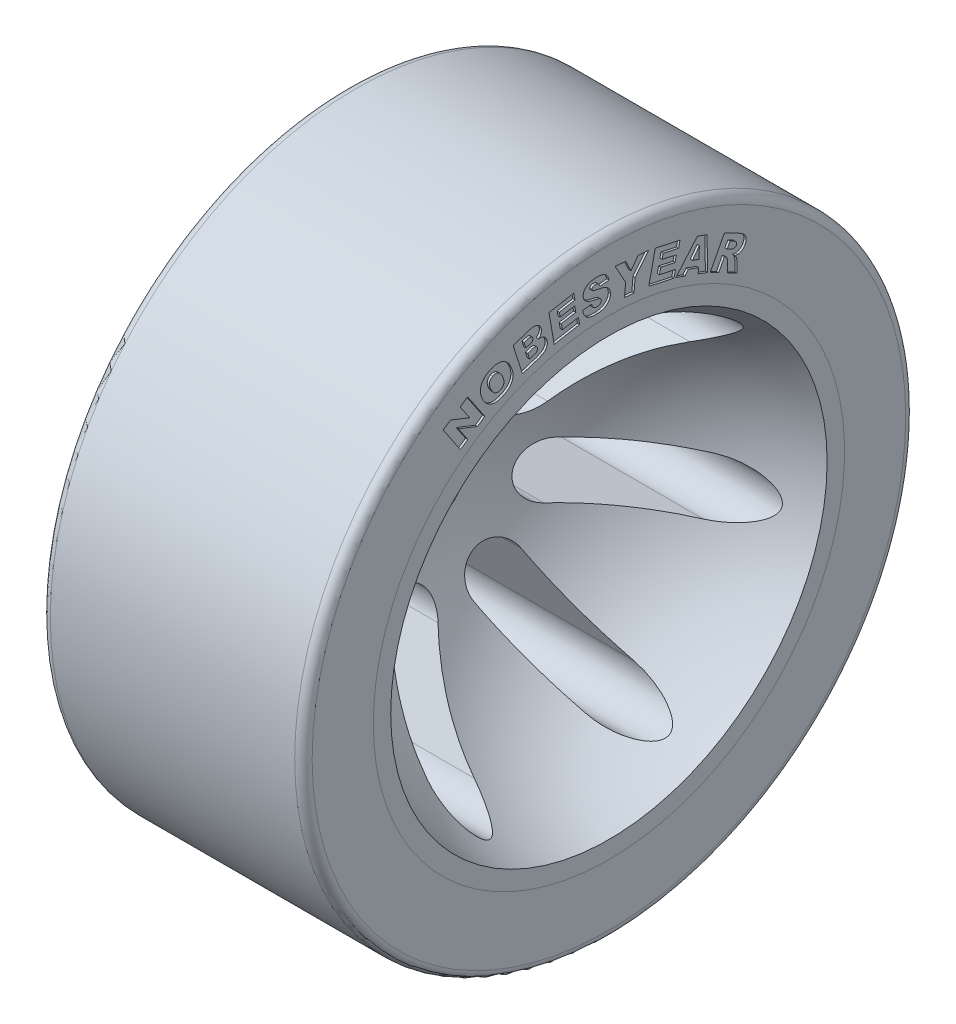
from build123d import *

# Parameters (mm, degrees)
SKETCH2_W           = 30
SKETCH2_H           = 8
FILLET1_R           = 1
SKETCH3_R           = 7.5
BOSS_EXTRUDE1_DEPTH = 10
SKETCH4_R           = 3.175
CUT_EXTRUDE1_DEPTH  = 64.63961048
CUT_EXTRUDE2_DEPTH  = 58.879184687
CIRPATTERN1_COUNT   = 7
CUT_EXTRUDE3_DEPTH  = 0.25


with BuildPart() as part:
    # Sketch1 → Hub (revolve)
    with BuildSketch(Plane.XY, mode=Mode.PRIVATE) as hub_sk:
        with BuildLine():
            Line((0, 0), (10, 0))
            ThreePointArc((10, 0), (15.47437581, 16.120499352), (30, 25))
            Line((30, 25), (30, 27))
            Line((30, 27), (0, 27))
            Line((0, 27), (0, 0))
        make_face()
    revolve(hub_sk.sketch.rotate(Axis((0, 0, 0), (1, 0, 0)), 90), axis=Axis((0, 0, 0), (1, 0, 0)))


with BuildPart() as body_2:
    # Sketch2 → Tire (revolve)
    with BuildSketch(Plane.XY, mode=Mode.PRIVATE) as tire_sk:
        with Locations((15, 31)):
            Rectangle(SKETCH2_W, SKETCH2_H)
    revolve(tire_sk.sketch.rotate(Axis((-1.5, 0, 0), (1, 0, 0)), 90), axis=Axis((-1.5, 0, 0), (1, 0, 0)))

    # Fillet1
    fillet1_edges = [body_2.edges().sort_by_distance(p)[0] for p in [
        (0, 0, -35),
        (30, 0, -35),
    ]]
    fillet(fillet1_edges, radius=FILLET1_R)

    # Sketch6 → Cut-Extrude3 (cut)
    # profile 1 of 9: a face of its own
    with BuildSketch(Plane(origin=(30, 0, 0), x_dir=(0, 0, -1), z_dir=(1, 0, 0))):
        Polygon((-18.993375251, 25.131214643), (-18.148204796, 25.700816915), (-15.952892296, 24.825106688), (-17.045221842, 26.445135097), (-16.192949114, 27.019708961), (-14.218517296, 24.091441915), (-15.070790023, 23.516868052), (-17.252608205, 24.384765779), (-16.16809116, 22.776811233), (-17.018943432, 22.202947597), align=None)
    # profile 2 of 9: a face of its own
    with BuildSketch(Plane(origin=(30, 0, 0), x_dir=(0, 0, -1), z_dir=(1, 0, 0))):
        with BuildLine():
            add(Edge.make_bspline(
                [(-14.495635258, 25.957333021), (-14.524596303, 26.020589457), (-14.581028049, 26.143847135), (-14.646506245, 26.331312387), (-14.693395657, 26.51475838), (-14.721109606, 26.694119267), (-14.731891855, 26.869219222), (-14.722710466, 27.040354689), (-14.693900257, 27.206982002), (-14.647855675, 27.369175888), (-14.583050319, 27.524329118), (-14.501536683, 27.672316029), (-14.401762005, 27.810938369), (-14.286497521, 27.942670247), (-14.152224142, 28.064159328), (-14.001879046, 28.177684617), (-13.834955016, 28.283854344), (-13.714486379, 28.344500075), (-13.652595485, 28.375656885)],
                knots=[0, 0, 0, 0, 1.147556844, 2.236060119, 3.271688379, 4.267888835, 5.226584, 6.161657968, 7.089078349, 8.011532036, 8.938013924, 9.857799998, 10.793330865, 11.751062409, 12.741000169, 13.775500434, 14.857160916, 16, 16, 16, 16], degree=3))
            add(Edge.make_bspline(
                [(-13.652595485, 28.375656885), (-13.588153108, 28.405088211), (-13.462728641, 28.462370524), (-13.272346669, 28.52911549), (-13.087164353, 28.578079959), (-12.906739334, 28.608648541), (-12.731031041, 28.619467165), (-12.560273136, 28.611830028), (-12.394282375, 28.585714388), (-12.234008297, 28.539850106), (-12.080483536, 28.476470656), (-11.934075203, 28.396493705), (-11.796874794, 28.298122661), (-11.666519863, 28.184297125), (-11.546714091, 28.051469993), (-11.433955718, 27.902856338), (-11.329308463, 27.737239922), (-11.268814833, 27.617903324), (-11.237822758, 27.556764839)],
                knots=[0, 0, 0, 0, 1.171891098, 2.280856497, 3.333726478, 4.338475981, 5.304026371, 6.241353904, 7.161752559, 8.078207226, 8.993455259, 9.905200075, 10.832452066, 11.781835806, 12.763505498, 13.786834529, 14.866151835, 16, 16, 16, 16], degree=3))
            add(Edge.make_bspline(
                [(-11.237822758, 27.556764839), (-11.216776094, 27.511506839), (-11.175519812, 27.42279079), (-11.122557619, 27.289193645), (-11.077445765, 27.1594792), (-11.041636142, 27.03284113), (-11.014466268, 26.909801214), (-10.996624844, 26.789937684), (-10.987198814, 26.673669281), (-10.986240898, 26.560640539), (-10.994493385, 26.450568799), (-11.009144918, 26.342997438), (-11.031812155, 26.237765575), (-11.062771529, 26.135161842), (-11.100158883, 26.034768394), (-11.145984884, 25.937045079), (-11.199525925, 25.841869025), (-11.259887269, 25.748619972), (-11.327869571, 25.658113998), (-11.405463414, 25.57206071), (-11.490397415, 25.488695034), (-11.584949601, 25.410205663), (-11.686619175, 25.333597175), (-11.797397772, 25.26162547), (-11.916561746, 25.193124035), (-11.999918502, 25.151292423), (-12.042510258, 25.129918249)],
                knots=[0, 0, 0, 0, 1.233425831, 2.417797208, 3.550282353, 4.626511627, 5.668653415, 6.66251431, 7.619322052, 8.549713982, 9.453126324, 10.345192288, 11.231211845, 12.110579057, 12.991988033, 13.87678948, 14.77533758, 15.689094136, 16.620644563, 17.569673324, 18.550355677, 19.55953236, 20.6045941, 21.695218295, 22.822354601, 24, 24, 24, 24], degree=3))
            add(Edge.make_bspline(
                [(-12.042510258, 25.129918249), (-12.086354926, 25.109367108), (-12.172042812, 25.069202959), (-12.301128787, 25.017397873), (-12.4267267, 24.973324492), (-12.549097186, 24.936558274), (-12.668492046, 24.908998922), (-12.784658408, 24.888844936), (-12.897563495, 24.876495568), (-13.007740178, 24.872749446), (-13.115753601, 24.8779365), (-13.222332822, 24.890700222), (-13.327846714, 24.911183315), (-13.432055276, 24.94058221), (-13.53497105, 24.978373512), (-13.636760317, 25.023969669), (-13.73737554, 25.077581326), (-13.836568168, 25.139133283), (-13.93343685, 25.209291557), (-14.025935439, 25.289495668), (-14.114897383, 25.378331476), (-14.199280297, 25.476653015), (-14.279753146, 25.583761706), (-14.356498603, 25.699642031), (-14.428917054, 25.824838306), (-14.473107328, 25.912595131), (-14.495635258, 25.957333021)],
                knots=[0, 0, 0, 0, 1.180994642, 2.308078441, 3.391145699, 4.427187976, 5.423184236, 6.378293821, 7.30174956, 8.191565589, 9.064524542, 9.936986702, 10.80793764, 11.683700077, 12.575257229, 13.480014828, 14.402314169, 15.354205886, 16.325656927, 17.316600957, 18.337483392, 19.389814632, 20.474358926, 21.60355643, 22.77830781, 24, 24, 24, 24], degree=3))
        make_face()
        with BuildLine():
            add(Edge.make_bspline(
                [(-13.518362531, 26.422531885), (-13.499368051, 26.384429117), (-13.462669583, 26.310812293), (-13.402715461, 26.207795241), (-13.342434216, 26.114897637), (-13.278614782, 26.034613369), (-13.214834226, 25.963960621), (-13.148805142, 25.905059063), (-13.081684256, 25.856194906), (-13.011871168, 25.820065683), (-12.941599213, 25.792754907), (-12.870192167, 25.775077666), (-12.798075575, 25.764518833), (-12.724860101, 25.764416504), (-12.650778688, 25.771365384), (-12.576067899, 25.787326062), (-12.500295977, 25.811395635), (-12.4511576, 25.833708481), (-12.426032985, 25.845117112)],
                knots=[0, 0, 0, 0, 1.451753448, 2.804874346, 4.063503266, 5.224980128, 6.299380172, 7.305912841, 8.238015884, 9.122931422, 9.979200078, 10.803697263, 11.627046977, 12.458787784, 13.294399992, 14.160661689, 15.059540244, 16, 16, 16, 16], degree=3))
            add(Edge.make_bspline(
                [(-12.426032985, 25.845117112), (-12.400933697, 25.857938744), (-12.351907486, 25.882983119), (-12.284007342, 25.927063436), (-12.224297427, 25.976227262), (-12.171820897, 26.029213825), (-12.126631359, 26.086158142), (-12.089568526, 26.147904263), (-12.059436252, 26.213546744), (-12.037072522, 26.284284316), (-12.023204468, 26.361095947), (-12.021157297, 26.445169149), (-12.0286034, 26.536260885), (-12.046040844, 26.634889483), (-12.074215074, 26.740923145), (-12.11298955, 26.854331423), (-12.161466017, 26.975422575), (-12.199540919, 27.057415706), (-12.219356849, 27.100088703)],
                knots=[0, 0, 0, 0, 0.928673853, 1.813970169, 2.662310032, 3.47351134, 4.268177454, 5.052467934, 5.841712529, 6.643854069, 7.49194263, 8.405541969, 9.407495453, 10.500610212, 11.70257545, 13.020409, 14.449283786, 16, 16, 16, 16], degree=3))
            add(Edge.make_bspline(
                [(-12.219356849, 27.100088703), (-12.237111081, 27.13585639), (-12.271389087, 27.20491288), (-12.328754093, 27.300823053), (-12.38664695, 27.387616977), (-12.447651501, 27.46351576), (-12.510410215, 27.529575442), (-12.575019089, 27.585553654), (-12.642337829, 27.630767274), (-12.711622216, 27.665884314), (-12.782432534, 27.691170515), (-12.85366271, 27.709706561), (-12.926038024, 27.71772445), (-12.999159019, 27.718795239), (-13.073151912, 27.710475083), (-13.148313168, 27.695113727), (-13.223961634, 27.669667379), (-13.273506755, 27.647614189), (-13.298902303, 27.636310294)],
                knots=[0, 0, 0, 0, 1.397080101, 2.697335408, 3.90846876, 5.045935185, 6.100820458, 7.093921255, 8.03154869, 8.932010844, 9.804868264, 10.658960914, 11.501724501, 12.346928528, 13.213470536, 14.102383644, 15.027330889, 16, 16, 16, 16], degree=3))
            add(Edge.make_bspline(
                [(-13.298902303, 27.636310294), (-13.322603701, 27.624227659), (-13.369135279, 27.600506523), (-13.43319581, 27.557640624), (-13.490555379, 27.509970612), (-13.540400178, 27.4569165), (-13.58421278, 27.399719572), (-13.621423093, 27.337650763), (-13.651155434, 27.270554355), (-13.674204896, 27.198749537), (-13.689437902, 27.121597862), (-13.694048936, 27.03851107), (-13.688466454, 26.949788526), (-13.674172533, 26.855163046), (-13.649610207, 26.754752494), (-13.614959193, 26.648945164), (-13.571636416, 26.536886328), (-13.536577904, 26.461631884), (-13.518362531, 26.422531885)],
                knots=[0, 0, 0, 0, 0.910332452, 1.787202857, 2.633136858, 3.458903744, 4.274460508, 5.09611858, 5.930751315, 6.781913036, 7.673830934, 8.615915255, 9.622742753, 10.713052165, 11.888854681, 13.15787868, 14.523317198, 16, 16, 16, 16], degree=3))
        make_face(mode=Mode.SUBTRACT)
    # profile 3 of 9: a face of its own
    with BuildSketch(Plane(origin=(30, 0, 0), x_dir=(0, 0, -1), z_dir=(1, 0, 0))):
        with BuildLine():
            Line((-10.972093337, 29.516051209), (-9.033172883, 30.131818255))
            add(Edge.make_bspline(
                [(-9.033172883, 30.131818255), (-8.993777011, 30.143453979), (-8.917014662, 30.166126038), (-8.802688195, 30.190749367), (-8.692602855, 30.203770949), (-8.587377923, 30.209843413), (-8.486743225, 30.203739521), (-8.390727264, 30.189168033), (-8.29920465, 30.164169495), (-8.212880042, 30.129447201), (-8.132776766, 30.086388144), (-8.058344647, 30.038606835), (-7.991820964, 29.983074782), (-7.93175565, 29.921944297), (-7.879083333, 29.854108654), (-7.833490988, 29.780179792), (-7.793807083, 29.70080344), (-7.774484441, 29.64415019), (-7.764706974, 29.615483028)],
                knots=[0, 0, 0, 0, 1.279270881, 2.492642879, 3.636824276, 4.729372547, 5.770756104, 6.77091085, 7.749411328, 8.718867964, 9.662287293, 10.578544374, 11.468857279, 12.355314276, 13.243272782, 14.137455373, 15.05753212, 16, 16, 16, 16], degree=3))
            add(Edge.make_bspline(
                [(-7.764706974, 29.615483028), (-7.757353452, 29.59098234), (-7.742866387, 29.542713897), (-7.729818773, 29.469108451), (-7.722243821, 29.396446928), (-7.722466619, 29.324612817), (-7.728874146, 29.253543684), (-7.74171248, 29.183442271), (-7.760627604, 29.113785869), (-7.778906463, 29.069149765), (-7.788144474, 29.046590982)],
                knots=[0, 0, 0, 0, 1.053603469, 2.075688686, 3.075829499, 4.061439649, 5.031516672, 6.013448437, 6.996010376, 8, 8, 8, 8], degree=3))
            add(Edge.make_bspline(
                [(-7.788144474, 29.046590982), (-7.803064206, 29.016426018), (-7.833911088, 28.954059277), (-7.90075304, 28.868372959), (-7.982009048, 28.784482553), (-8.04553723, 28.73453776), (-8.078627428, 28.7085228)],
                knots=[0, 0, 0, 0, 0.894549398, 1.849500995, 2.879860327, 4, 4, 4, 4], degree=3))
            add(Edge.make_bspline(
                [(-8.078627428, 28.7085228), (-8.046914852, 28.710024375), (-7.985163504, 28.712948272), (-7.894732249, 28.711937213), (-7.809075222, 28.703920076), (-7.728244782, 28.690843134), (-7.652096636, 28.671226791), (-7.580337485, 28.647116739), (-7.513986946, 28.615089868), (-7.451666598, 28.578971054), (-7.39409235, 28.537037105), (-7.341286053, 28.489489689), (-7.29201646, 28.437922933), (-7.247784697, 28.380247902), (-7.207367606, 28.317813149), (-7.170991598, 28.250236574), (-7.139812495, 28.177285715), (-7.122343376, 28.126490157), (-7.113428565, 28.100568255)],
                knots=[0, 0, 0, 0, 1.22059454, 2.376765533, 3.473654745, 4.525662559, 5.521345012, 6.494342261, 7.430846902, 8.348809484, 9.260977018, 10.16355646, 11.077901442, 11.999197657, 12.953580485, 13.935056434, 14.946221559, 16, 16, 16, 16], degree=3))
            add(Edge.make_bspline(
                [(-7.113428565, 28.100568255), (-7.101375361, 28.057731257), (-7.077678836, 27.973513981), (-7.062571174, 27.844612762), (-7.063405047, 27.717496093), (-7.083054418, 27.593352818), (-7.117835612, 27.473817091), (-7.16726452, 27.36059997), (-7.231072845, 27.254113016), (-7.285059127, 27.191235383), (-7.312292201, 27.159517118)],
                knots=[0, 0, 0, 0, 1.057525373, 2.079088399, 3.076269033, 4.073783777, 5.0596339, 6.030890041, 7.00669366, 8, 8, 8, 8], degree=3))
            add(Edge.make_bspline(
                [(-7.312292201, 27.159517118), (-7.332648904, 27.139543141), (-7.376634455, 27.096384563), (-7.458853482, 27.039096396), (-7.557485472, 26.980069376), (-7.63110424, 26.944208864), (-7.670246746, 26.925142118)],
                knots=[0, 0, 0, 0, 0.794468545, 1.716640263, 2.785956023, 4, 4, 4, 4], degree=3))
            add(Edge.make_bspline(
                [(-7.670246746, 26.925142118), (-7.696949021, 26.912486591), (-7.748067676, 26.888258936), (-7.821993442, 26.855293725), (-7.888472572, 26.825051084), (-7.948548027, 26.799972619), (-8.000857307, 26.77655857), (-8.047068969, 26.758537239), (-8.085881805, 26.743134397), (-8.109840474, 26.735407876), (-8.120530837, 26.7319603)],
                knots=[0, 0, 0, 0, 1.446630275, 2.769419248, 3.962732965, 5.021979233, 5.956434204, 6.767851108, 7.450214908, 8, 8, 8, 8], degree=3))
            Line((-8.120530837, 26.7319603), (-9.908172883, 26.164488709))
            Line((-9.908172883, 26.164488709), (-10.972093337, 29.516051209))
        make_face()
        with BuildLine():
            Line((-9.509735383, 28.533096664), (-9.059451292, 28.675852346))
            add(Edge.make_bspline(
                [(-9.059451292, 28.675852346), (-9.040225884, 28.68233907), (-9.003171143, 28.694841479), (-8.950550547, 28.715145022), (-8.90334047, 28.737252621), (-8.861586812, 28.760549085), (-8.824912088, 28.784576596), (-8.793973451, 28.810144245), (-8.768995559, 28.837401853), (-8.742227268, 28.874228724), (-8.719429158, 28.925429091), (-8.707406831, 28.992306694), (-8.710480647, 29.064558069), (-8.723676894, 29.112362425), (-8.730616065, 29.137500073)],
                knots=[0, 0, 0, 0, 1.120953654, 2.160507993, 3.11423721, 3.99843588, 4.800136749, 5.533640066, 6.209358931, 6.83731205, 8.043184075, 9.266870723, 10.562799556, 12, 12, 12, 12], degree=3))
            add(Edge.make_bspline(
                [(-8.730616065, 29.137500073), (-8.738865225, 29.160461615), (-8.754689514, 29.204508531), (-8.793449264, 29.260933946), (-8.84084851, 29.306080706), (-8.888364866, 29.332753461), (-8.930671369, 29.348109176), (-8.966591748, 29.355035371), (-9.005909327, 29.357568744), (-9.048643903, 29.35666949), (-9.095284355, 29.352623504), (-9.145197265, 29.342853158), (-9.198770927, 29.330113862), (-9.235163773, 29.319266688), (-9.254053565, 29.313636437)],
                knots=[0, 0, 0, 0, 1.386527332, 2.659762711, 3.863298009, 5.090828397, 5.735661307, 6.424109439, 7.168657542, 7.978864769, 8.860198351, 9.834746752, 10.876120286, 12, 12, 12, 12], degree=3))
            Line((-9.254053565, 29.313636437), (-9.711439928, 29.168750073))
            Line((-9.711439928, 29.168750073), (-9.509735383, 28.533096664))
        make_face(mode=Mode.SUBTRACT)
        with BuildLine():
            Line((-9.092121746, 27.2163353), (-8.563712655, 27.383948937))
            add(Edge.make_bspline(
                [(-8.563712655, 27.383948937), (-8.542317621, 27.391046939), (-8.501055517, 27.404736027), (-8.443109487, 27.428298958), (-8.390528588, 27.452166404), (-8.344353054, 27.478564395), (-8.303566843, 27.506164352), (-8.268783067, 27.5351349), (-8.239420019, 27.565279417), (-8.209886249, 27.607588432), (-8.1822873, 27.663739409), (-8.167762136, 27.736394705), (-8.167948801, 27.812607248), (-8.181143595, 27.8623522), (-8.188002428, 27.8882103)],
                knots=[0, 0, 0, 0, 1.133131178, 2.185337813, 3.1439592, 4.034294013, 4.856444491, 5.616995985, 6.307426723, 6.964737626, 8.205324068, 9.421686987, 10.659757952, 12, 12, 12, 12], degree=3))
            add(Edge.make_bspline(
                [(-8.188002428, 27.8882103), (-8.196655563, 27.911692847), (-8.213380096, 27.95707925), (-8.255516282, 28.015530939), (-8.308547244, 28.062092904), (-8.361685263, 28.090244085), (-8.409766433, 28.105055754), (-8.450430228, 28.113055319), (-8.495534571, 28.115675412), (-8.544645838, 28.1128816), (-8.598137041, 28.107594814), (-8.655658263, 28.09636803), (-8.717545634, 28.08155263), (-8.759795305, 28.068828634), (-8.781752428, 28.062215982)],
                knots=[0, 0, 0, 0, 1.277628968, 2.469365164, 3.647187149, 4.868265973, 5.516742257, 6.221036158, 6.986902775, 7.824814305, 8.739889839, 9.739304934, 10.82511843, 12, 12, 12, 12], degree=3))
            Line((-8.781752428, 28.062215982), (-9.30732061, 27.895312573))
            Line((-9.30732061, 27.895312573), (-9.092121746, 27.2163353))
        make_face(mode=Mode.SUBTRACT)
    # profile 4 of 9: a face of its own
    with BuildSketch(Plane(origin=(30, 0, 0), x_dir=(0, 0, -1), z_dir=(1, 0, 0))):
        Polygon((-6.873120161, 30.717790475), (-4.017296297, 31.221341611), (-3.888034934, 30.484835929), (-5.676387206, 30.16949502), (-5.579796297, 29.621909793), (-3.920705388, 29.914523429), (-3.796415615, 29.210688202), (-5.455506524, 28.918074566), (-5.335478115, 28.238387066), (-3.495279252, 28.562960929), (-3.357495161, 27.781710929), (-6.265165615, 27.268926838), align=None)
    # profile 5 of 9: a face of its own
    with BuildSketch(Plane(origin=(30, 0, 0), x_dir=(0, 0, -1), z_dir=(1, 0, 0))):
        with BuildLine():
            Line((-3.011666543, 28.996198137), (-1.982547225, 29.111254955))
            add(Edge.make_bspline(
                [(-1.982547225, 29.111254955), (-1.974070123, 29.071992448), (-1.957987793, 28.997505603), (-1.923463422, 28.894507436), (-1.881029971, 28.806257579), (-1.843883831, 28.757301989), (-1.826297225, 28.734124274)],
                knots=[0, 0, 0, 0, 1.167882679, 2.215648025, 3.155209809, 4, 4, 4, 4], degree=3))
            add(Edge.make_bspline(
                [(-1.826297225, 28.734124274), (-1.81100651, 28.717920812), (-1.780810254, 28.685922056), (-1.729883926, 28.644113465), (-1.674251989, 28.610182679), (-1.614722888, 28.582731402), (-1.550886357, 28.563074755), (-1.483104552, 28.54943325), (-1.410930047, 28.543154069), (-1.361578982, 28.544039157), (-1.336240407, 28.544493592)],
                knots=[0, 0, 0, 0, 0.980712201, 1.936720183, 2.891760862, 3.843665298, 4.81658511, 5.82684459, 6.884225486, 8, 8, 8, 8], degree=3))
            add(Edge.make_bspline(
                [(-1.336240407, 28.544493592), (-1.299594653, 28.547315782), (-1.230131004, 28.552665369), (-1.13381727, 28.578814585), (-1.050472266, 28.615879717), (-0.983252938, 28.667798973), (-0.931551988, 28.727724882), (-0.893103036, 28.791203041), (-0.872058388, 28.859940291), (-0.870911142, 28.906576657), (-0.870331316, 28.930147001)],
                knots=[0, 0, 0, 0, 1.306717763, 2.4769414, 3.537240005, 4.535870782, 5.474467313, 6.343818816, 7.162954521, 8, 8, 8, 8], degree=3))
            add(Edge.make_bspline(
                [(-0.870331316, 28.930147001), (-0.872832149, 28.952408123), (-0.877857096, 28.997137614), (-0.904889402, 29.060769645), (-0.946350397, 29.119587133), (-0.982769382, 29.152410779), (-1.001723362, 29.169493592)],
                knots=[0, 0, 0, 0, 0.951977257, 1.91281726, 2.913741864, 4, 4, 4, 4], degree=3))
            add(Edge.make_bspline(
                [(-1.001723362, 29.169493592), (-1.013608999, 29.17807731), (-1.039590169, 29.196840716), (-1.086348715, 29.220473928), (-1.142975022, 29.242710866), (-1.208703095, 29.265541518), (-1.284698656, 29.286612147), (-1.370280881, 29.306898903), (-1.465710846, 29.326877489), (-1.532700379, 29.338719522), (-1.567774498, 29.344919728)],
                knots=[0, 0, 0, 0, 0.588585232, 1.286606049, 2.097669232, 3.033543426, 4.081817059, 5.265813536, 6.568445323, 8, 8, 8, 8], degree=3))
            add(Edge.make_bspline(
                [(-1.567774498, 29.344919728), (-1.62587659, 29.355557019), (-1.73849675, 29.376175441), (-1.900219846, 29.414088246), (-2.049754766, 29.454732592), (-2.186249081, 29.500217609), (-2.31022189, 29.54891695), (-2.421615376, 29.601570891), (-2.521233216, 29.657504009), (-2.580006114, 29.701096222), (-2.608257452, 29.72205041)],
                knots=[0, 0, 0, 0, 1.269179615, 2.460069949, 3.568456884, 4.59810589, 5.550403483, 6.428828684, 7.244759161, 8, 8, 8, 8], degree=3))
            add(Edge.make_bspline(
                [(-2.608257452, 29.72205041), (-2.6338282, 29.743310645), (-2.684145145, 29.785145561), (-2.750370102, 29.855938187), (-2.807262081, 29.931834228), (-2.85382164, 30.013278928), (-2.892899683, 30.098810231), (-2.921365042, 30.189933042), (-2.93970972, 30.286038622), (-2.945040487, 30.351949821), (-2.947746089, 30.385402683)],
                knots=[0, 0, 0, 0, 1.035814183, 2.038227726, 3.01385107, 3.985979199, 4.957098373, 5.939730276, 6.95432157, 8, 8, 8, 8], degree=3))
            add(Edge.make_bspline(
                [(-2.947746089, 30.385402683), (-2.948290232, 30.430247989), (-2.949375287, 30.519672407), (-2.924266304, 30.652295819), (-2.881060875, 30.781751183), (-2.829627744, 30.885930541), (-2.77774403, 30.965706157), (-2.734035618, 31.024014552), (-2.684496956, 31.078757767), (-2.630646976, 31.131121669), (-2.570322527, 31.178785808), (-2.506632437, 31.225738116), (-2.436563297, 31.267839745), (-2.361758701, 31.308166272), (-2.280105801, 31.344462624), (-2.19141035, 31.377089141), (-2.094958016, 31.405181189), (-1.991518396, 31.43036964), (-1.880078805, 31.449444578), (-1.761758433, 31.466845244), (-1.635683758, 31.479607157), (-1.549095738, 31.484466213), (-1.504564271, 31.486965183)],
                knots=[0, 0, 0, 0, 1.316125397, 2.624438466, 3.945397879, 5.32158219, 6.026437792, 6.742143739, 7.461968988, 8.195633488, 8.948052299, 9.720967213, 10.520969045, 11.349455066, 12.21893339, 13.146248361, 14.126516352, 15.171777512, 16.275215779, 17.449826113, 18.688467715, 20, 20, 20, 20], degree=3))
            add(Edge.make_bspline(
                [(-1.504564271, 31.486965183), (-1.450122759, 31.488991157), (-1.34431471, 31.492928674), (-1.190131464, 31.488671896), (-1.045512235, 31.475793444), (-0.910186737, 31.456144838), (-0.785100699, 31.425696121), (-0.668818832, 31.389550875), (-0.562798897, 31.342855682), (-0.465072246, 31.289128831), (-0.37709259, 31.225169369), (-0.297369609, 31.152521925), (-0.227503649, 31.068923397), (-0.165352131, 30.976197979), (-0.112234162, 30.873351413), (-0.067457458, 30.76107151), (-0.031050173, 30.639352355), (-0.014485165, 30.554133358), (-0.005984725, 30.510402683)],
                knots=[0, 0, 0, 0, 1.304710694, 2.535728524, 3.691402443, 4.781318336, 5.807390719, 6.772214376, 7.694051888, 8.577521148, 9.438463607, 10.293314968, 11.154444162, 12.041491448, 12.962194541, 13.92150306, 14.933405936, 16, 16, 16, 16], degree=3))
            Line((-0.005984725, 30.510402683), (-1.026581316, 30.400317455))
            add(Edge.make_bspline(
                [(-1.026581316, 30.400317455), (-1.035848043, 30.43715853), (-1.053374741, 30.506838189), (-1.09601354, 30.600448923), (-1.147579649, 30.678936641), (-1.21290032, 30.739274514), (-1.288545123, 30.784574029), (-1.37607169, 30.813186727), (-1.474619828, 30.829102064), (-1.544039714, 30.827832114), (-1.580558589, 30.827164046)],
                knots=[0, 0, 0, 0, 1.170341321, 2.213534329, 3.160037379, 4.049298802, 4.934045414, 5.860679878, 6.874593898, 8, 8, 8, 8], degree=3))
            add(Edge.make_bspline(
                [(-1.580558589, 30.827164046), (-1.610270561, 30.824962671), (-1.66630179, 30.820811287), (-1.743818006, 30.801700764), (-1.809547874, 30.773284641), (-1.86271476, 30.735577133), (-1.903165799, 30.690832792), (-1.931832186, 30.6418481), (-1.94738337, 30.588286635), (-1.948095281, 30.551689617), (-1.948456316, 30.533129955)],
                knots=[0, 0, 0, 0, 1.353945565, 2.553288448, 3.614351042, 4.594972503, 5.495056103, 6.339588046, 7.157945502, 8, 8, 8, 8], degree=3))
            add(Edge.make_bspline(
                [(-1.948456316, 30.533129955), (-1.946716658, 30.519487201), (-1.943212584, 30.492007538), (-1.926063238, 30.452502766), (-1.898241703, 30.416568745), (-1.874309664, 30.396563037), (-1.861808589, 30.38611291)],
                knots=[0, 0, 0, 0, 0.933221435, 1.87972389, 2.892458343, 4, 4, 4, 4], degree=3))
            add(Edge.make_bspline(
                [(-1.861808589, 30.38611291), (-1.854130042, 30.380455169), (-1.837400676, 30.368128561), (-1.807034677, 30.35297863), (-1.770510575, 30.337969212), (-1.727199696, 30.324124214), (-1.677431257, 30.310634534), (-1.62115242, 30.298245606), (-1.55858267, 30.284926824), (-1.514313533, 30.278160105), (-1.491069952, 30.274607228)],
                knots=[0, 0, 0, 0, 0.585439607, 1.275506188, 2.078241647, 3.012558428, 4.068225543, 5.24748728, 6.554788863, 8, 8, 8, 8], degree=3))
            add(Edge.make_bspline(
                [(-1.491069952, 30.274607228), (-1.433253685, 30.264948101), (-1.321442286, 30.24626823), (-1.160585209, 30.214647189), (-1.012015362, 30.183698455), (-0.876130311, 30.152172526), (-0.753427561, 30.118442696), (-0.642686988, 30.085661917), (-0.545005525, 30.050749492), (-0.457946474, 30.015860906), (-0.38051275, 29.978162563), (-0.308649946, 29.939366177), (-0.243164825, 29.89631529), (-0.181167491, 29.852576715), (-0.125414228, 29.804956718), (-0.074491932, 29.754987098), (-0.028845514, 29.702279761), (0.024684115, 29.628848453), (0.080432865, 29.530869685), (0.131495642, 29.405717733), (0.164858531, 29.272169007), (0.172604779, 29.180092281), (0.176543684, 29.133272001)],
                knots=[0, 0, 0, 0, 1.586058795, 3.067293336, 4.435502218, 5.692554233, 6.840968207, 7.878547516, 8.816653854, 9.6469951, 10.414864224, 11.145966122, 11.854954902, 12.53411506, 13.197688365, 13.836398904, 14.4631432, 15.082013553, 16.292939842, 17.502747273, 18.730166912, 20, 20, 20, 20], degree=3))
            add(Edge.make_bspline(
                [(0.176543684, 29.133272001), (0.177484524, 29.105333439), (0.179351808, 29.049883841), (0.173901836, 28.967266082), (0.163213868, 28.885900221), (0.147260209, 28.805728078), (0.123950147, 28.727119258), (0.09582572, 28.649867081), (0.061363099, 28.57391147), (0.021044463, 28.499995485), (-0.024090224, 28.428273233), (-0.074713799, 28.360625242), (-0.130241989, 28.297189252), (-0.191018739, 28.238079849), (-0.256289184, 28.182819293), (-0.326231145, 28.1310748), (-0.401777666, 28.084757965), (-0.481554117, 28.040878441), (-0.566747977, 28.001900289), (-0.65782854, 27.967922402), (-0.753938028, 27.937286302), (-0.856243867, 27.911847276), (-0.964113449, 27.890653317), (-1.077650247, 27.873820291), (-1.196817089, 27.860797104), (-1.278210774, 27.855933742), (-1.31990518, 27.853442455)],
                knots=[0, 0, 0, 0, 0.907841004, 1.801789935, 2.686289387, 3.573360791, 4.454609566, 5.347763817, 6.242870393, 7.161918535, 8.08170682, 8.994034228, 9.904381242, 10.818263975, 11.746091092, 12.681540138, 13.64208207, 14.623135022, 15.638569274, 16.682961011, 17.780182393, 18.914527289, 20.106337836, 21.350901325, 22.642983246, 24, 24, 24, 24], degree=3))
            add(Edge.make_bspline(
                [(-1.31990518, 27.853442455), (-1.391868328, 27.850942767), (-1.530129981, 27.846140154), (-1.729604439, 27.852668179), (-1.912501901, 27.869440395), (-2.078804105, 27.899226358), (-2.228877604, 27.93952772), (-2.362116198, 27.993011553), (-2.479339236, 28.057211232), (-2.579325771, 28.134803733), (-2.665238435, 28.221271163), (-2.742537556, 28.313048219), (-2.810164818, 28.411743932), (-2.869224197, 28.516240688), (-2.919414431, 28.62715835), (-2.95952692, 28.744486893), (-2.991198528, 28.86800869), (-3.004765647, 28.952978408), (-3.011666543, 28.996198137)],
                knots=[0, 0, 0, 0, 1.500405067, 2.882704403, 4.156788487, 5.324994039, 6.399978045, 7.389547468, 8.310678103, 9.176211009, 10.017074736, 10.847214878, 11.673887025, 12.506852549, 13.346035243, 14.207394979, 15.088193946, 16, 16, 16, 16], degree=3))
        make_face()
    # profile 6 of 9: a face of its own
    with BuildSketch(Plane(origin=(30, 0, 0), x_dir=(0, 0, -1), z_dir=(1, 0, 0))):
        Polygon((0.71559655, 31.510405635), (1.920852232, 31.409553362), (2.530937459, 30.163104499), (3.339886323, 31.290235181), (4.538749959, 31.190093135), (3.001107914, 29.26182609), (2.877528369, 27.790235181), (1.789460187, 27.881854499), (1.913039732, 29.353445408), align=None)
    # profile 7 of 9: a face of its own
    with BuildSketch(Plane(origin=(30, 0, 0), x_dir=(0, 0, -1), z_dir=(1, 0, 0))):
        Polygon((5.310172541, 31.02069381), (8.139007768, 30.404216537), (7.979916859, 29.674813128), (6.209320268, 30.061176764), (6.090712314, 29.518563128), (7.733467996, 29.159898355), (7.581479359, 28.463165401), (5.938723678, 28.821830173), (5.791706632, 28.147824492), (7.614149814, 27.750097219), (7.44582595, 26.976659719), (4.565144132, 27.604500628), align=None)
    # profile 8 of 9: a face of its own
    with BuildSketch(Plane(origin=(30, 0, 0), x_dir=(0, 0, -1), z_dir=(1, 0, 0))):
        Polygon((10.258100668, 26.61670127), (9.090487032, 27.037155816), (8.731822259, 26.547098997), (7.683526805, 26.924939906), (10.126708623, 29.794258088), (11.24460635, 29.391559225), (11.297163168, 25.623803543), (10.224009759, 26.010167179), align=None)
        Polygon((10.301424532, 27.412155816), (10.364634759, 28.737439906), (9.570600668, 27.674939906), align=None, mode=Mode.SUBTRACT)
    # profile 9 of 9: a face of its own
    with BuildSketch(Plane(origin=(30, 0, 0), x_dir=(0, 0, -1), z_dir=(1, 0, 0))):
        with BuildLine():
            Line((11.60044499, 25.458607427), (13.233967717, 28.582186973))
            Line((13.233967717, 28.582186973), (14.84263249, 27.741277882))
            add(Edge.make_bspline(
                [(14.84263249, 27.741277882), (14.878706648, 27.72202833), (14.948642221, 27.684709969), (15.048781116, 27.627818772), (15.141372594, 27.572545804), (15.22595666, 27.518172993), (15.302229231, 27.463786927), (15.371033155, 27.411100752), (15.431632545, 27.358815514), (15.485754215, 27.308166802), (15.533542463, 27.256595797), (15.574784968, 27.201985066), (15.611712428, 27.145340674), (15.644093795, 27.086208789), (15.670359544, 27.023992494), (15.691327697, 26.959230626), (15.708983314, 26.8922744), (15.71976131, 26.82277442), (15.72661468, 26.751856277), (15.726521958, 26.680045959), (15.719892976, 26.607872234), (15.707686058, 26.535260667), (15.690169291, 26.461981219), (15.665421595, 26.388658762), (15.635900962, 26.314363616), (15.611479206, 26.26596191), (15.599024535, 26.241277882)],
                knots=[0, 0, 0, 0, 1.525754858, 2.957921776, 4.297245312, 5.54941349, 6.70886425, 7.792067532, 8.781904698, 9.694279924, 10.557152928, 11.40174265, 12.244667425, 13.078749925, 13.913954509, 14.760436432, 15.617501222, 16.494726528, 17.381728329, 18.273993762, 19.169794661, 20.083323954, 21.019677596, 21.977905161, 22.9687668, 24, 24, 24, 24], degree=3))
            add(Edge.make_bspline(
                [(15.599024535, 26.241277882), (15.575966315, 26.199852066), (15.53129615, 26.119598776), (15.447857801, 26.01364243), (15.357318734, 25.922015861), (15.255749075, 25.848857297), (15.147942922, 25.789797112), (15.033399095, 25.747087292), (14.913743576, 25.715655785), (14.831222174, 25.708152102), (14.789365444, 25.704346064)],
                knots=[0, 0, 0, 0, 1.114942872, 2.159953403, 3.165301118, 4.138869555, 5.096907536, 6.051630046, 7.011742476, 8, 8, 8, 8], degree=3))
            add(Edge.make_bspline(
                [(14.789365444, 25.704346064), (14.760697961, 25.703456354), (14.69989924, 25.701569436), (14.603771133, 25.71256978), (14.497641324, 25.729889386), (14.424432819, 25.74806204), (14.385956353, 25.757613109)],
                knots=[0, 0, 0, 0, 0.84164753, 1.784987298, 2.835847533, 4, 4, 4, 4], degree=3))
            add(Edge.make_bspline(
                [(14.385956353, 25.757613109), (14.407982552, 25.734154349), (14.449227405, 25.690226973), (14.503233769, 25.625692888), (14.546550831, 25.567770537), (14.567451669, 25.528924551), (14.57700749, 25.511164245)],
                knots=[0, 0, 0, 0, 1.233744432, 2.310231042, 3.227441113, 4, 4, 4, 4], degree=3))
            add(Edge.make_bspline(
                [(14.57700749, 25.511164245), (14.582971584, 25.498014014), (14.596830896, 25.467455616), (14.612607918, 25.412584576), (14.629626166, 25.344086201), (14.646158089, 25.266095356), (14.661470599, 25.187091938), (14.671892814, 25.115259846), (14.679321182, 25.054881791), (14.67978377, 25.018282869), (14.679990444, 25.001931291)],
                knots=[0, 0, 0, 0, 0.663268478, 1.541297811, 2.618559156, 3.910379512, 5.206413133, 6.318002118, 7.248521038, 8, 8, 8, 8], degree=3))
            Line((14.679990444, 25.001931291), (14.672888171, 23.852073336))
            Line((14.672888171, 23.852073336), (13.581979081, 24.422385836))
            Line((13.581979081, 24.422385836), (13.565643853, 25.646817655))
            add(Edge.make_bspline(
                [(13.565643853, 25.646817655), (13.56495111, 25.683304034), (13.563670976, 25.750727921), (13.555005434, 25.84292938), (13.540688394, 25.918202873), (13.52404001, 25.960429946), (13.516638171, 25.979204018)],
                knots=[0, 0, 0, 0, 1.294459479, 2.392056692, 3.285111633, 4, 4, 4, 4], degree=3))
            add(Edge.make_bspline(
                [(13.516638171, 25.979204018), (13.504650508, 25.999467467), (13.480762994, 26.039845928), (13.434968447, 26.093631806), (13.379905075, 26.138974123), (13.33873579, 26.162996038), (13.317774535, 26.175226745)],
                knots=[0, 0, 0, 0, 0.995639265, 1.983985112, 2.973550263, 4, 4, 4, 4], degree=3))
            Line((13.317774535, 26.175226745), (13.232547262, 26.219971064))
            Line((13.232547262, 26.219971064), (12.569905217, 24.952215382))
            Line((12.569905217, 24.952215382), (11.60044499, 25.458607427))
        make_face()
        with BuildLine():
            Line((13.541496126, 26.810169927), (13.948456353, 26.597101745))
            add(Edge.make_bspline(
                [(13.948456353, 26.597101745), (13.962338104, 26.590733464), (13.995627189, 26.575462028), (14.056510394, 26.55515723), (14.135140241, 26.53108294), (14.193904622, 26.515012373), (14.226155217, 26.506192655)],
                knots=[0, 0, 0, 0, 0.626100958, 1.501419323, 2.628749078, 4, 4, 4, 4], degree=3))
            add(Edge.make_bspline(
                [(14.226155217, 26.506192655), (14.243571958, 26.501928591), (14.278059847, 26.493485074), (14.331174158, 26.493399792), (14.383654505, 26.501891775), (14.434404465, 26.520714259), (14.482421913, 26.547171071), (14.524904784, 26.582060449), (14.561763545, 26.623370984), (14.580375771, 26.655448031), (14.589791581, 26.671675609)],
                knots=[0, 0, 0, 0, 0.991331902, 1.962993261, 2.921346621, 3.926407502, 4.949150106, 5.947758572, 6.96178386, 8, 8, 8, 8], degree=3))
            add(Edge.make_bspline(
                [(14.589791581, 26.671675609), (14.60129822, 26.696137995), (14.62321131, 26.742723837), (14.637765807, 26.816392482), (14.635879437, 26.88736295), (14.620256293, 26.944144763), (14.598490289, 26.988066882), (14.574642135, 27.021223482), (14.544544109, 27.054678843), (14.507749788, 27.08821648), (14.464489276, 27.122069043), (14.414575023, 27.156057725), (14.358388699, 27.190197627), (14.318124885, 27.211651013), (14.297177944, 27.222811973)],
                knots=[0, 0, 0, 0, 1.355578765, 2.581546157, 3.737085788, 4.898377757, 5.510754009, 6.194556734, 6.94508108, 7.770887091, 8.695125532, 9.705755923, 10.806437089, 12, 12, 12, 12], degree=3))
            Line((14.297177944, 27.222811973), (13.873172262, 27.445113109))
            Line((13.873172262, 27.445113109), (13.541496126, 26.810169927))
        make_face(mode=Mode.SUBTRACT)
    extrude(amount=-CUT_EXTRUDE3_DEPTH, mode=Mode.SUBTRACT)


with BuildPart() as body_3:
    # Sketch3 → Boss-Extrude1 (new body)
    with BuildSketch(Plane.ZY):
        Circle(SKETCH3_R)
    extrude(amount=BOSS_EXTRUDE1_DEPTH)


with BuildPart() as cut_extrude1_tool:
    # Sketch4 → Cut-Extrude1 (new, through all)
    with BuildSketch(Plane.ZY.offset(10)):
        Circle(SKETCH4_R)
    extrude(amount=-CUT_EXTRUDE1_DEPTH)


with BuildPart() as part_1:
    add(part.part)

    # Cut-Extrude1: cut by cut_extrude1_tool
    add(cut_extrude1_tool.part, mode=Mode.SUBTRACT)

    # Sketch5 → Cut-Extrude2 (cut, through all)
    with BuildSketch(Plane.ZY):
        with BuildLine():
            Line((-3, 11), (-3, 21))
            ThreePointArc((-3, 21), (0, 24), (3, 21))
            Line((3, 21), (3, 11))
            ThreePointArc((3, 11), (0, 8), (-3, 11))
        make_face()
    cut_extrude2 = extrude(amount=-CUT_EXTRUDE2_DEPTH, mode=Mode.SUBTRACT)

    # CirPattern1: Cut-Extrude2 ×7 about axis
    cirpattern1_axis = Axis((0, 0, 0), (1, 0, 0))
    for i in range(1, CIRPATTERN1_COUNT):
        add(cut_extrude2.rotate(cirpattern1_axis, i * 360 / CIRPATTERN1_COUNT), mode=Mode.SUBTRACT)


with BuildPart() as body_3_1:
    add(body_3.part)

    # Cut-Extrude1: cut by cut_extrude1_tool
    add(cut_extrude1_tool.part, mode=Mode.SUBTRACT)


solid = Compound([body_2.part, part_1.part, body_3_1.part])
